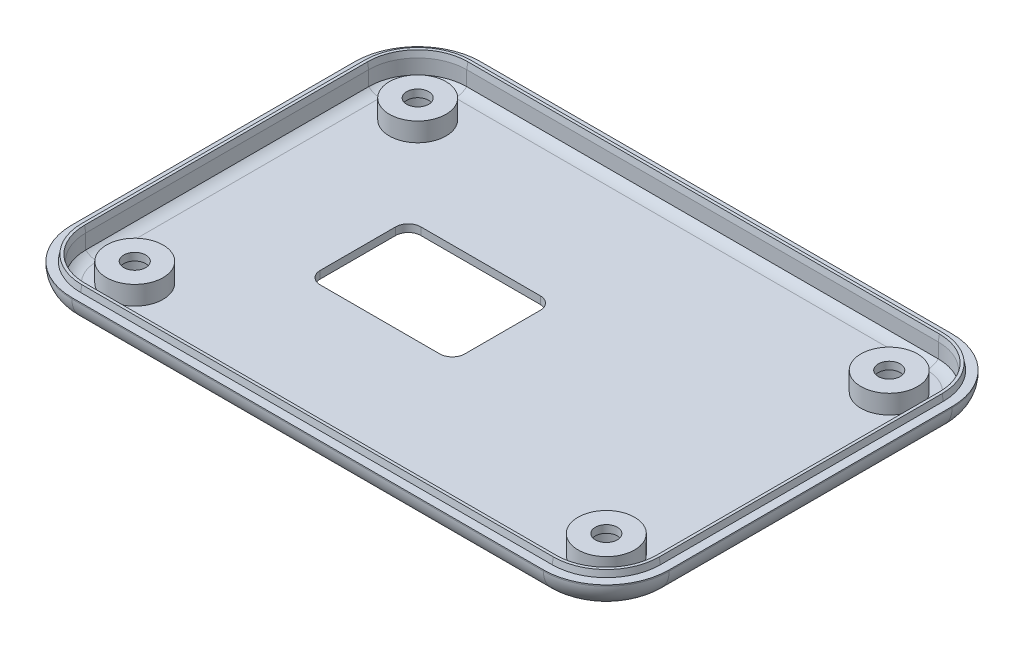
from build123d import *

# Parameters (mm, degrees)
SKETCH1_W           = 95
SKETCH1_H           = 65
BOSS_EXTRUDE1_DEPTH = 4.2
FILLET1_R           = 10
FILLET2_R           = 4
SHELL1_T            = -1.2
SKETCH5_R           = 4.5
BOSS_EXTRUDE3_DEPTH = 3
SKETCH7_R           = 1.75
CUT_EXTRUDE2_DEPTH  = 10
BOSS_EXTRUDE4_REACH = 117.185
BOSS_EXTRUDE5_DEPTH = 1
BOSS_EXTRUDE5_DRAFT = 10
SKETCH12_R          = 3.5
CUT_EXTRUDE3_DEPTH  = 3
SKETCH13_W          = 23
SKETCH13_H          = 16
CUT_EXTRUDE4_DEPTH  = 116.226038806
FILLET3_R           = 2


with BuildPart() as part:
    # Sketch1 → Boss-Extrude1 (new body)
    with BuildSketch(Plane(origin=(0, 0, 0), x_dir=(1, 0, 0), z_dir=(0, 1, 0))):
        with Locations((47.5, 32.5)):
            Rectangle(SKETCH1_W, SKETCH1_H)
    extrude(amount=BOSS_EXTRUDE1_DEPTH)

    # Fillet1
    fillet1_edges = [part.edges().sort_by_distance(p)[0] for p in [
        (0, 2.1, -65),
        (95, 2.1, -65),
        (95, 2.1, 0),
        (0, 2.1, 0),
    ]]
    fillet(fillet1_edges, radius=FILLET1_R)

    # Fillet2
    fillet2_edges = [part.edges().sort_by_distance(p)[0] for p in [
        (95, 0, -32.5),
        (0, 0, -32.5),
        (47.5, 0, -65),
        (47.5, 0, 0),
        (2.928932188, 0, -2.928932188),
        (2.928932188, 0, -62.071067812),
        (92.071067812, 0, -62.071067812),
        (92.071067812, 0, -2.928932188),
    ]]
    fillet(fillet2_edges, radius=FILLET2_R)

    # Shell1
    shell1_openings = [part.faces().sort_by_distance(p)[0] for p in [
        (47.5, 4.2, -32.5),
    ]]
    offset(amount=SHELL1_T, openings=shell1_openings, kind=Kind.INTERSECTION)

    # Sketch5 → Boss-Extrude3 (add)
    with BuildSketch(Plane(origin=(0, 1.2, 0), x_dir=(1, 0, 0), z_dir=(0, 1, 0))):
        with Locations(Location((10, 55, 0), (0, 0, 90))):
            Circle(SKETCH5_R)
        with Locations(Location((85, 55, 0), (0, 0, 90))):
            Circle(SKETCH5_R)
        with Locations(Location((85, 10, 0), (0, 0, 90))):
            Circle(SKETCH5_R)
        with Locations(Location((10, 10, 0), (0, 0, 90))):
            Circle(SKETCH5_R)
    extrude(amount=BOSS_EXTRUDE3_DEPTH)

    # Sketch7 → Cut-Extrude2 (cut)
    with BuildSketch(Plane(origin=(0, 4.2, 0), x_dir=(1, 0, 0), z_dir=(0, 1, 0))):
        with Locations(Location((10, 55, 0), (0, 0, 270))):
            Circle(SKETCH7_R)
        with Locations(Location((85, 55, 0), (0, 0, 270))):
            Circle(SKETCH7_R)
        with Locations(Location((85, 10, 0), (0, 0, 270))):
            Circle(SKETCH7_R)
        with Locations(Location((10, 10, 0), (0, 0, 270))):
            Circle(SKETCH7_R)
    extrude(amount=-CUT_EXTRUDE2_DEPTH, mode=Mode.SUBTRACT)

    # Sketch8 → Boss-Extrude4 (add, up to next)
    with BuildSketch(Plane(origin=(0, 4.2, 0), x_dir=(1, 0, 0), z_dir=(0, 1, 0)), mode=Mode.PRIVATE) as boss_extrude4_sk1:
        with BuildLine():
            Line((1.2, 55), (1.2, 10))
            ThreePointArc((1.2, 10), (3.777460326, 3.777460326), (10, 1.2))
            Line((10, 1.2), (85, 1.2))
            ThreePointArc((85, 1.2), (91.222539674, 3.777460326), (93.8, 10))
            Line((93.8, 10), (93.8, 55))
            ThreePointArc((93.8, 55), (91.222539674, 61.222539674), (85, 63.8))
            Line((85, 63.8), (10, 63.8))
            ThreePointArc((10, 63.8), (3.777460326, 61.222539674), (1.2, 55))
        make_face()
        with BuildLine():
            Line((85, 62.8), (10, 62.8))
            ThreePointArc((10, 62.8), (4.484567107, 60.515432893), (2.2, 55))
            Line((2.2, 55), (2.2, 10))
            ThreePointArc((2.2, 10), (4.484567107, 4.484567107), (10, 2.2))
            Line((10, 2.2), (85, 2.2))
            ThreePointArc((85, 2.2), (90.515432893, 4.484567107), (92.8, 10))
            Line((92.8, 10), (92.8, 55))
            ThreePointArc((92.8, 55), (90.515432893, 60.515432893), (85, 62.8))
        make_face(mode=Mode.SUBTRACT)
    boss_extrude4_tool1 = extrude(boss_extrude4_sk1.sketch, amount=-BOSS_EXTRUDE4_REACH, mode=Mode.PRIVATE) - part.part
    add(boss_extrude4_tool1.solids().sort_by_distance((1.311774, 4.2, -32.5))[0])


with BuildPart() as boss_extrude5_tool:
    # Sketch11 → Boss-Extrude5 (with draft: the straight prism first)
    with BuildSketch(Plane(origin=(0, 4.2, 0), x_dir=(1, 0, 0), z_dir=(0, 1, 0))):
        with BuildLine():
            Line((93.6, 10), (93.6, 55))
            ThreePointArc((93.6, 55), (91.081118318, 61.081118318), (85, 63.6))
            Line((85, 63.6), (10, 63.6))
            ThreePointArc((10, 63.6), (3.918881682, 61.081118318), (1.4, 55))
            Line((1.4, 55), (1.4, 10))
            ThreePointArc((1.4, 10), (3.918881682, 3.918881682), (10, 1.4))
            Line((10, 1.4), (85, 1.4))
            ThreePointArc((85, 1.4), (91.081118318, 3.918881682), (93.6, 10))
        make_face()
        with BuildLine():
            Line((92.8, 10), (92.8, 55))
            ThreePointArc((92.8, 55), (90.515432893, 60.515432893), (85, 62.8))
            Line((85, 62.8), (10, 62.8))
            ThreePointArc((10, 62.8), (4.484567107, 60.515432893), (2.2, 55))
            Line((2.2, 55), (2.2, 10))
            ThreePointArc((2.2, 10), (4.484567107, 4.484567107), (10, 2.2))
            Line((10, 2.2), (85, 2.2))
            ThreePointArc((85, 2.2), (90.515432893, 4.484567107), (92.8, 10))
        make_face(mode=Mode.SUBTRACT)
    extrude(amount=BOSS_EXTRUDE5_DEPTH)
    # Boss-Extrude5: the draft: its side faces are tilted about the plane it starts from
    boss_extrude5_sides = [boss_extrude5_tool.faces().sort_by_distance(p)[0] for p in [
        (91.081118318, 4.7, -3.918881682),
        (93.6, 4.7, -32.5),
        (91.081118318, 4.7, -61.081118318),
        (47.5, 4.7, -63.6),
        (3.918881682, 4.7, -61.081118318),
        (1.4, 4.7, -32.5),
        (3.918881682, 4.7, -3.918881682),
        (47.5, 4.7, -1.4),
        (47.5, 4.7, -2.2),
        (4.484567107, 4.7, -4.484567107),
        (2.2, 4.7, -32.5),
        (4.484567107, 4.7, -60.515432893),
        (47.5, 4.7, -62.8),
        (90.515432893, 4.7, -60.515432893),
        (92.8, 4.7, -32.5),
        (90.515432893, 4.7, -4.484567107),
    ]]
    draft(boss_extrude5_sides, Plane(origin=(0, 4.2, 0), x_dir=(1, 0, 0), z_dir=(0, 1, 0)), BOSS_EXTRUDE5_DRAFT)


with BuildPart() as part_1:
    add(part.part)

    # Boss-Extrude5: add boss_extrude5_tool
    add(boss_extrude5_tool.part)

    # Sketch12 → Cut-Extrude3 (cut)
    with BuildSketch(Plane.XZ):
        with Locations(Location((10, -10, 0), (0, 0, 270))):
            Circle(SKETCH12_R)
        with Locations(Location((85, -10, 0), (0, 0, 270))):
            Circle(SKETCH12_R)
        with Locations(Location((85, -55, 0), (0, 0, 270))):
            Circle(SKETCH12_R)
        with Locations(Location((10, -55, 0), (0, 0, 270))):
            Circle(SKETCH12_R)
    extrude(amount=-CUT_EXTRUDE3_DEPTH, mode=Mode.SUBTRACT)

    # Sketch13 → Cut-Extrude4 (cut, through all)
    with BuildSketch(Plane.XZ):
        with Locations((34.5, -32.5)):
            Rectangle(SKETCH13_W, SKETCH13_H)
    extrude(amount=-CUT_EXTRUDE4_DEPTH, mode=Mode.SUBTRACT)

    # Fillet3
    fillet3_edges = [part_1.edges().sort_by_distance(p)[0] for p in [
        (46, 0.6, -24.5),
        (46, 0.6, -40.5),
        (23, 0.6, -40.5),
        (23, 0.6, -24.5),
    ]]
    fillet(fillet3_edges, radius=FILLET3_R)


solid = part_1.part
